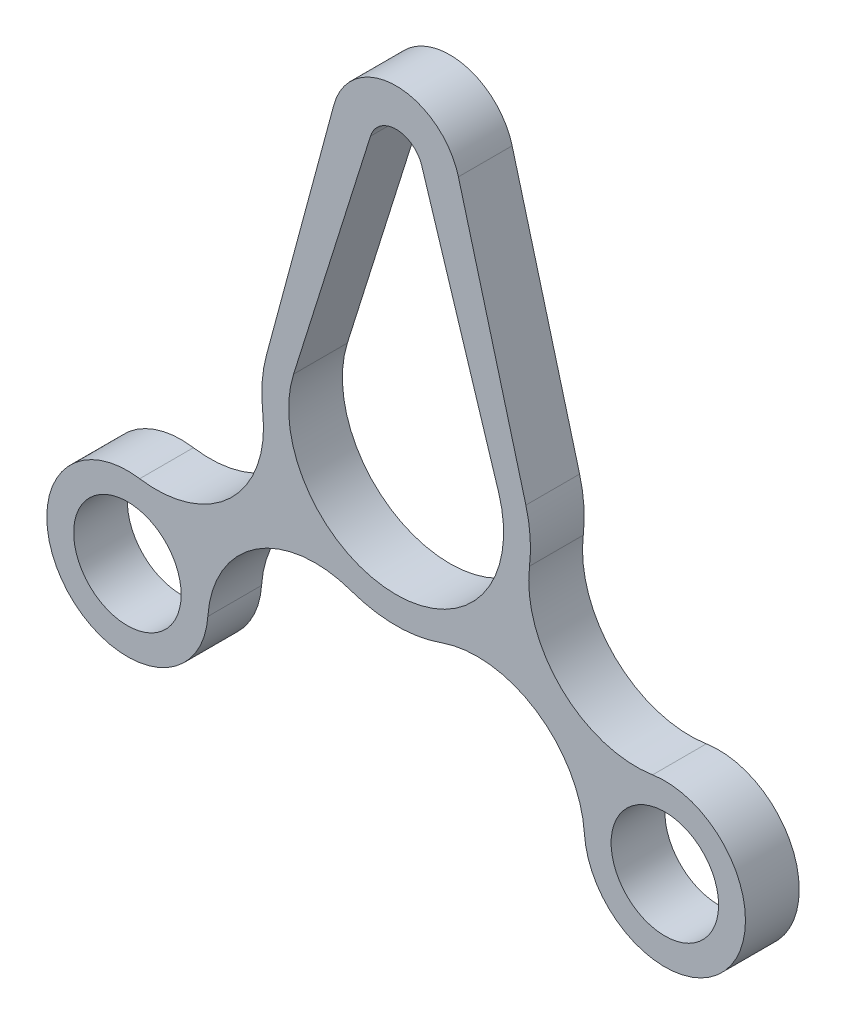
from build123d import *

# Parameters (mm, degrees)
SKETCH1_R           = 15
SKETCH1_R_2         = 10
BOSS_EXTRUDE1_DEPTH = 10


with BuildPart() as part:
    # Sketch1 → Boss-Extrude1 (new body)
    # profile 1 of 3: a face of its own
    with BuildSketch(Plane.XY):
        with BuildLine():
            Line((-11.587303396, 53.12), (-24.140215409, 6.5))
            ThreePointArc((-24.140215409, 6.5), (-24.936514863, 1.780512988), (-24.81883517, -3.004233816))
            ThreePointArc((-24.81883517, -3.004233816), (-30.762049538, -19.776348187), (-47.717387131, -25.174694658))
            ThreePointArc((-47.717387131, -25.174694658), (-38.614939767, -30.233710864), (-35, -40))
            ThreePointArc((-35, -40), (-35.008809114, -40.513999826), (-35.03522611, -41.027395935))
            ThreePointArc((-35.03522611, -41.027395935), (-26.046643252, -25.670606045), (-8.378996809, -23.554031767))
            ThreePointArc((-8.378996809, -23.554031767), (0, -25), (8.378996809, -23.554031767))
            ThreePointArc((8.378996809, -23.554031767), (26.046643252, -25.670606045), (35.03522611, -41.027395935))
            ThreePointArc((35.03522611, -41.027395935), (38.286967858, -30.629574287), (47.717387131, -25.174694658))
            ThreePointArc((47.717387131, -25.174694658), (30.762049538, -19.776348187), (24.81883517, -3.004233816))
            ThreePointArc((24.81883517, -3.004233816), (24.936514863, 1.780512988), (24.140215409, 6.5))
            Line((24.140215409, 6.5), (11.587303396, 53.12))
            ThreePointArc((11.587303396, 53.12), (0, 62), (-11.587303396, 53.12))
        make_face()
        with BuildLine():
            ThreePointArc((19.078784028, 6), (0, -20), (-19.078784028, 6))
            Line((-19.078784028, 6), (-4.769696007, 51.5))
            ThreePointArc((-4.769696007, 51.5), (0, 55), (4.769696007, 51.5))
            Line((4.769696007, 51.5), (19.078784028, 6))
        make_face(mode=Mode.SUBTRACT)
    # profile 2 of 3: a face of its own
    with BuildSketch(Plane.XY):
        with Locations((-50, -40)):
            Circle(SKETCH1_R)
        with Locations((-50, -40)):
            Circle(SKETCH1_R_2, mode=Mode.SUBTRACT)
    # profile 3 of 3: a face of its own
    with BuildSketch(Plane.XY):
        with Locations((50, -40)):
            Circle(SKETCH1_R)
        with Locations((50, -40)):
            Circle(SKETCH1_R_2, mode=Mode.SUBTRACT)
    extrude(amount=BOSS_EXTRUDE1_DEPTH)


solid = part.part
